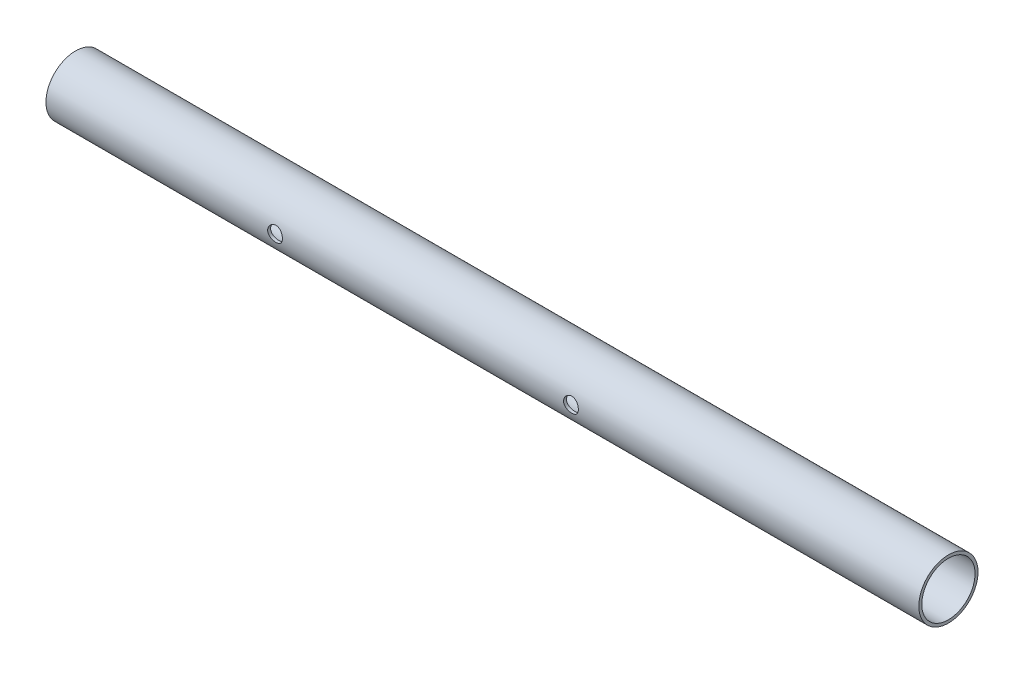
from build123d import *

# Parameters (mm, degrees)
SKETCH1_R               = 20
BOSS_EXTRUDE1_DEPTH     = 590
SKETCH2_R               = 18
CUT_EXTRUDE1_DEPTH      = 602
CUT_EXTRUDE2_DEPTH      = 591.677577025
CUT_EXTRUDE2_DEPTH_BACK = 591.677577025
SKETCH3_R               = 5


with BuildPart() as part:
    # Sketch1 → Boss-Extrude1 (new body)
    with BuildSketch(Plane(origin=(0, 0, 0), x_dir=(0, 0, -1), z_dir=(1, 0, 0))):
        Circle(SKETCH1_R)
    extrude(amount=BOSS_EXTRUDE1_DEPTH)

    # Sketch2 → Cut-Extrude1 (cut)
    with BuildSketch(Plane(origin=(590, 0, 0), x_dir=(0, 0, -1), z_dir=(1, 0, 0))):
        Circle(SKETCH2_R)
    extrude(amount=-CUT_EXTRUDE1_DEPTH, mode=Mode.SUBTRACT)

    # Sketch3 → Cut-Extrude2 (cut, two sides: drawn at the far end of the back side and taken through both)
    with BuildSketch(Plane.XY.offset(-CUT_EXTRUDE2_DEPTH_BACK)):
        with Locations((154.855292025, 0)):
            Circle(SKETCH3_R)
        with Locations((354.855292025, 0)):
            Circle(SKETCH3_R)
    extrude(amount=CUT_EXTRUDE2_DEPTH + CUT_EXTRUDE2_DEPTH_BACK, mode=Mode.SUBTRACT)


solid = part.part
